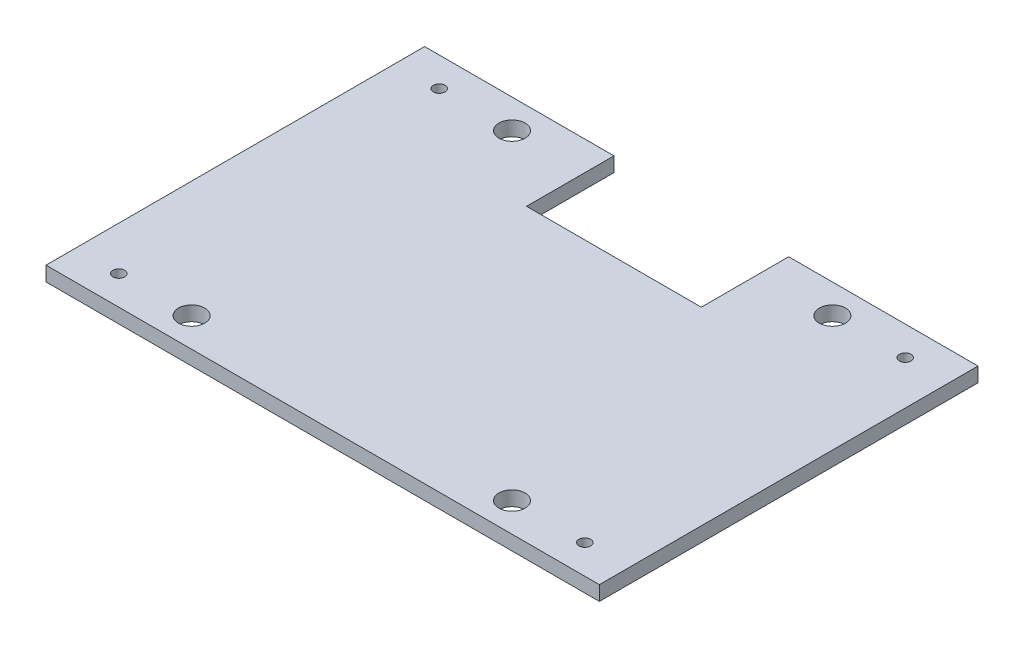
from build123d import *

# Parameters (mm, degrees)
SKETCH_1_R      = 4.5
SKETCH_1_R_2    = 2
EXTRUDE_1_DEPTH = 5


with BuildPart() as part:
    # 草图1 → 凸台-拉伸1 (new body)
    with BuildSketch(Plane(origin=(0, 0, 0), x_dir=(1, 0, 0), z_dir=(0, 1, 0))):
        Polygon((30, 65), (95, 65), (95, -65), (-95, -65), (-95, 65), (-30, 65), (-30, 35), (30, 35), align=None)
        with Locations(Location((-55, 55, 0), (0, 0, 270))):
            Circle(SKETCH_1_R, mode=Mode.SUBTRACT)
        with Locations(Location((55, 55, 0), (0, 0, 90))):
            Circle(SKETCH_1_R, mode=Mode.SUBTRACT)
        with Locations(Location((55, -55, 0), (0, 0, 270))):
            Circle(SKETCH_1_R, mode=Mode.SUBTRACT)
        with Locations(Location((-55, -55, 0), (0, 0, 90))):
            Circle(SKETCH_1_R, mode=Mode.SUBTRACT)
        with Locations(Location((-80, 55, 0), (0, 0, 270))):
            Circle(SKETCH_1_R_2, mode=Mode.SUBTRACT)
        with Locations(Location((-80, -55, 0), (0, 0, 90))):
            Circle(SKETCH_1_R_2, mode=Mode.SUBTRACT)
        with Locations(Location((80, -55, 0), (0, 0, 270))):
            Circle(SKETCH_1_R_2, mode=Mode.SUBTRACT)
        with Locations(Location((80, 55, 0), (0, 0, 90))):
            Circle(SKETCH_1_R_2, mode=Mode.SUBTRACT)
    extrude(amount=EXTRUDE_1_DEPTH)


solid = part.part
